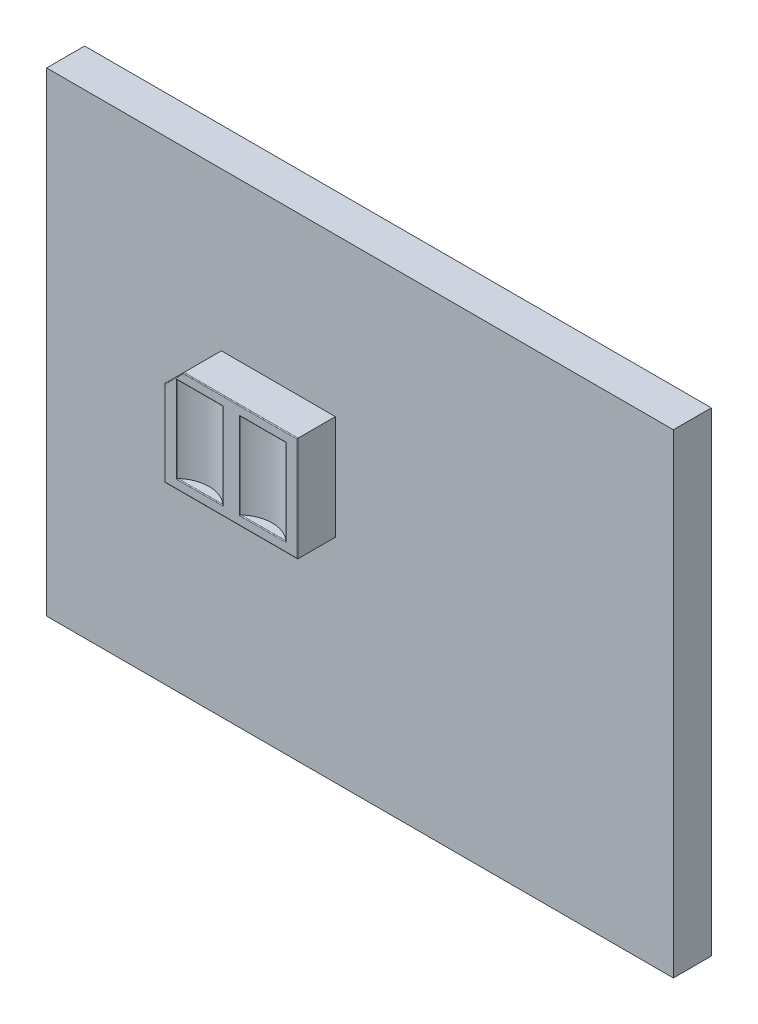
from build123d import *

# Parameters (mm, degrees)
ESQUISSE1_W             = 16.5
ESQUISSE1_H             = 12.5
EXTRUSION1_DEPTH        = 1
EXTRUSION2_DEPTH        = 2
ENL_V_MAT_EXTRU_1_DEPTH = 2.25
CONG_1_R                = 0.02


with BuildPart() as part:
    # Esquisse1 → Extrusion1 (new body)
    with BuildSketch(Plane.XY):
        Rectangle(ESQUISSE1_W, ESQUISSE1_H)
    extrude(amount=EXTRUSION1_DEPTH)

    # Esquisse3 → Extrusion2 (add)
    with BuildSketch(Plane.XY):
        Polygon((-3.65, 2.1), (-0.65, 2.1), (-0.65, -0.65), (-4.15, -0.65), (-4.15, 1.6), align=None)
    extrude(amount=EXTRUSION2_DEPTH)

    # Esquisse4 → Enlèv. mat.-Extru.1 (cut)
    with BuildSketch(Plane.XZ.offset(0.4)):
        with BuildLine():
            Line((-2.168200503, 2), (-0.947989573, 2))
            ThreePointArc((-0.947989573, 2), (-1.558095038, 1.755105285), (-2.168200503, 2))
        make_face()
        with BuildLine():
            Line((-2.607402818, 2), (-3.827613748, 2))
            ThreePointArc((-3.827613748, 2), (-3.217508283, 1.755105285), (-2.607402818, 2))
        make_face()
    extrude(amount=-ENL_V_MAT_EXTRU_1_DEPTH, mode=Mode.SUBTRACT)

    # Congé1
    cong_1_edges = [part.edges().sort_by_distance(p)[0] for p in [
        (-2.15, 2.1, 2),
        (-0.65, 0.725, 2),
        (-2.4, -0.65, 2),
        (-4.15, 0.475, 2),
        (-3.9, 1.85, 2),
        (-2.168200503, 0.725, 2),
        (-1.558095038, 1.85, 2),
        (-0.947989573, 0.725, 2),
        (-1.558095038, -0.4, 2),
        (-3.217508283, -0.4, 2),
        (-3.827613748, 0.725, 2),
        (-3.217508283, 1.85, 2),
        (-2.607402818, 0.725, 2),
    ]]
    fillet(cong_1_edges, radius=CONG_1_R)


solid = part.part
